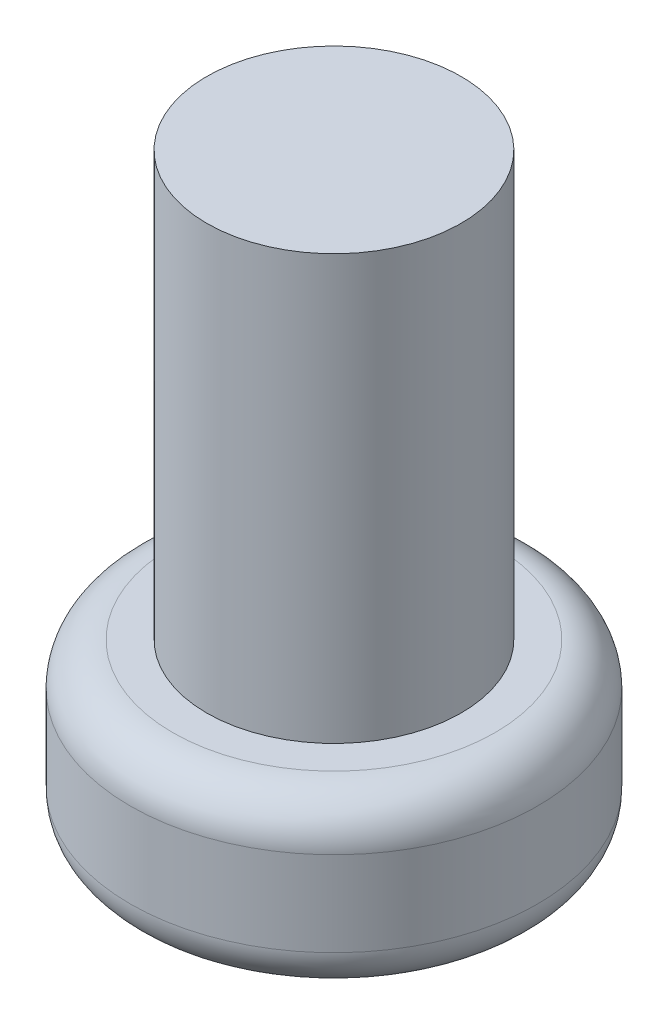
from build123d import *

# Parameters (mm, degrees)
SKETCH1_R           = 2.4
BOSS_EXTRUDE1_DEPTH = 2
SKETCH2_R           = 1.5
BOSS_EXTRUDE2_DEPTH = 5
FILLET1_R           = 0.5
CUT_EXTRUDE1_DEPTH  = 0.5


with BuildPart() as part:
    # Sketch1 → Boss-Extrude1 (new body)
    with BuildSketch(Plane(origin=(0, 0, 0), x_dir=(1, 0, 0), z_dir=(0, 1, 0))):
        with Locations(Location((0, 0, 0), (0, 0, 270))):
            Circle(SKETCH1_R)
    extrude(amount=BOSS_EXTRUDE1_DEPTH)

    # Sketch2 → Boss-Extrude2 (add)
    with BuildSketch(Plane(origin=(0, 2, 0), x_dir=(1, 0, 0), z_dir=(0, 1, 0))):
        with Locations(Location((0, 0, 0), (0, 0, 270))):
            Circle(SKETCH2_R)
    extrude(amount=BOSS_EXTRUDE2_DEPTH)

    # Fillet1
    fillet1_edges = [part.edges().sort_by_distance(p)[0] for p in [
        (0, 0, -2.4),
        (0, 2, -2.4),
    ]]
    fillet(fillet1_edges, radius=FILLET1_R)

    # Sketch3 → Cut-Extrude1 (cut)
    with BuildSketch(Plane.XZ):
        Polygon((0.5, 0.5), (1.5, 0.5), (1.5, -0.5), (0.5, -0.5), (0.5, -1.5), (-0.5, -1.5), (-0.5, -0.5), (-1.5, -0.5), (-1.5, 0.5), (-0.5, 0.5), (-0.5, 1.5), (0.5, 1.5), align=None)
    extrude(amount=-CUT_EXTRUDE1_DEPTH, mode=Mode.SUBTRACT)


solid = part.part
